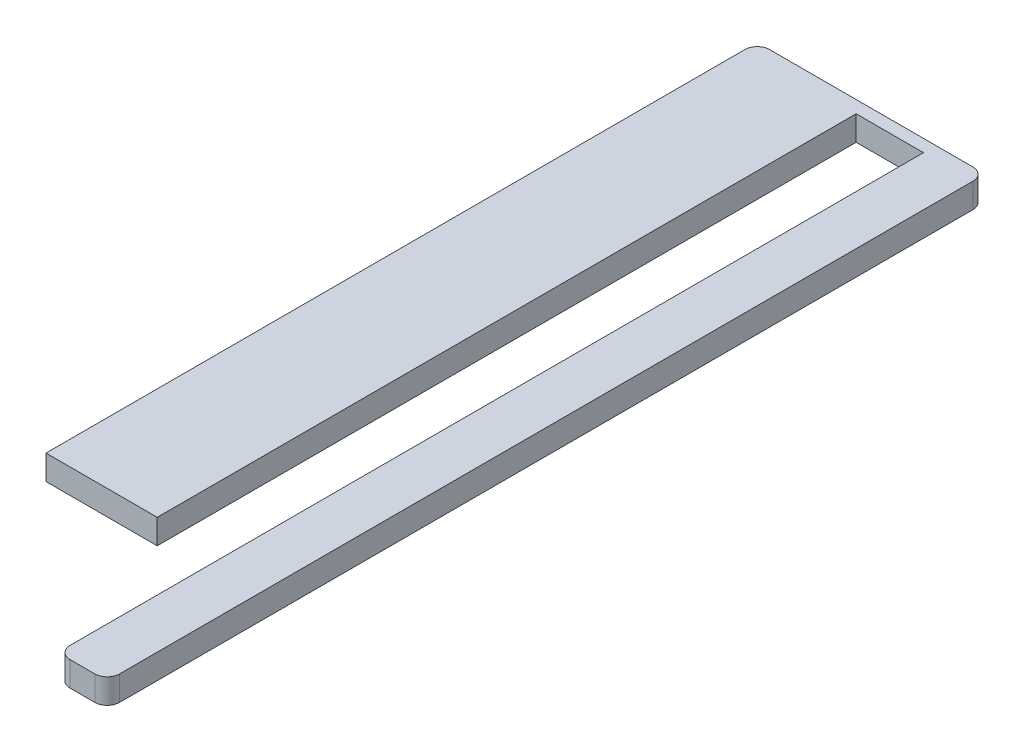
from build123d import *

# Parameters (mm, degrees)
EXTRUDE_1_DEPTH = 2


with BuildPart() as part:
    # ｽｹｯﾁ2 → ﾎﾞｽ - 押し出し1 (new body)
    with BuildSketch(Plane(origin=(0, 0, 0), x_dir=(1, 0, 0), z_dir=(0, 1, 0))):
        with BuildLine():
            Line((0, 0), (9, 0))
            Line((9, 0), (9, 56.55))
            Line((9, 56.55), (14.45, 56.55))
            Line((14.45, 56.55), (14.45, -12.5))
            ThreePointArc((14.45, -12.5), (14.742893219, -13.207106781), (15.45, -13.5))
            Line((15.45, -13.5), (17.45, -13.5))
            ThreePointArc((17.45, -13.5), (18.157106781, -13.207106781), (18.45, -12.5))
            Line((18.45, -12.5), (18.45, 56.55))
            ThreePointArc((18.45, 56.55), (18.157106781, 57.257106781), (17.45, 57.55))
            Line((17.45, 57.55), (1, 57.55))
            ThreePointArc((1, 57.55), (0.292893219, 57.257106781), (0, 56.55))
            Line((0, 56.55), (0, 0))
        make_face()
    extrude(amount=EXTRUDE_1_DEPTH)


solid = part.part
